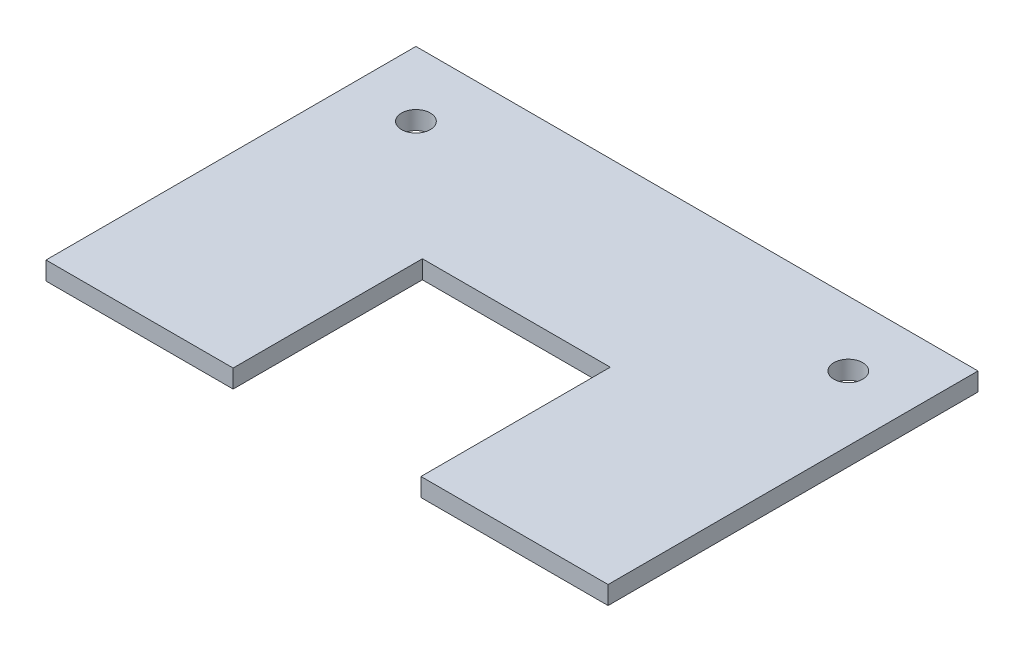
from build123d import *

# Parameters (mm, degrees)
EXTRUDE_1_DEPTH     = 1.9
CUT_EXTRUDE_1_REACH = 72.058
SKETCH_2_R          = 1.5


with BuildPart() as part:
    # 草图1 → 凸台-拉伸1 (new body)
    with BuildSketch(Plane(origin=(0, 0, 0), x_dir=(1, 0, 0), z_dir=(0, 1, 0))):
        Polygon((0, 0), (58.5, 0), (58.5, -38.5), (39.025, -38.5), (39.025, -18.8), (19.475, -18.8), (19.475, -38.5), (0, -38.5), align=None)
    extrude(amount=EXTRUDE_1_DEPTH)

    # 草图2 → 切除-拉伸1 (cut, up to next)
    with BuildSketch(Plane.XZ, mode=Mode.PRIVATE) as cut_extrude_1_sk1:
        with Locations(Location((51.75, 6.75, 0), (0, 0, 270))):
            Circle(SKETCH_2_R)
    cut_extrude_1_tool1 = extrude(cut_extrude_1_sk1.sketch, amount=-CUT_EXTRUDE_1_REACH, mode=Mode.PRIVATE) & part.part
    # 草图2 → 切除-拉伸1 (cut, up to next)
    with BuildSketch(Plane.XZ, mode=Mode.PRIVATE) as cut_extrude_1_sk2:
        with Locations(Location((6.75, 6.75, 0), (0, 0, 270))):
            Circle(SKETCH_2_R)
    cut_extrude_1_tool2 = extrude(cut_extrude_1_sk2.sketch, amount=-CUT_EXTRUDE_1_REACH, mode=Mode.PRIVATE) & part.part
    add(cut_extrude_1_tool1.solids().sort_by_distance((51.75, 0, 6.75))[0], mode=Mode.SUBTRACT)
    add(cut_extrude_1_tool2.solids().sort_by_distance((6.75, 0, 6.75))[0], mode=Mode.SUBTRACT)


solid = part.part
